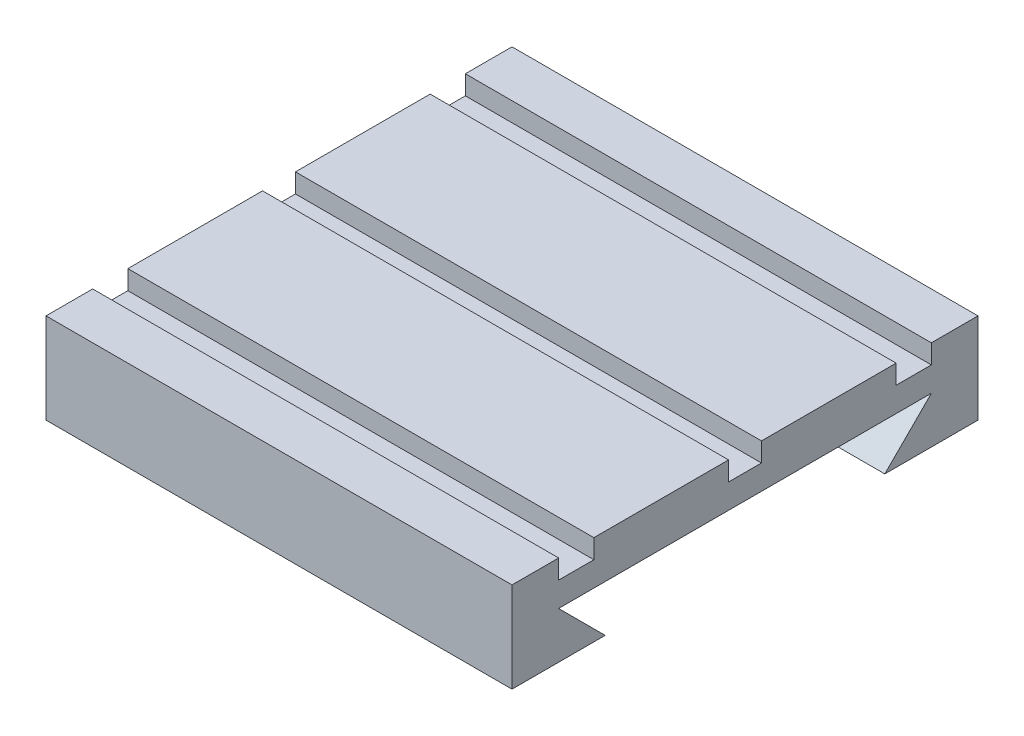
from build123d import *

# Parameters (mm, degrees)
SALIENTE_EXTRUIR1_DEPTH = 100
CROQUIS2_W              = 10.010901807
CROQUIS2_H              = 4.106706179
CROQUIS2_W_2            = 28.903824567
SALIENTE_EXTRUIR2_DEPTH = 100


with BuildPart() as part:
    # Croquis1 → Saliente-Extruir1 (new body)
    with BuildSketch(Plane(origin=(0, 0, 0), x_dir=(0, 0, -1), z_dir=(1, 0, 0))):
        Polygon((-30, 3.5), (-40, 13.5), (40, 13.5), (30, 3.5), (50, 3.5), (50, 18.770945102), (-50, 18.770945102), (-50, 3.5), align=None)
    extrude(amount=SALIENTE_EXTRUIR1_DEPTH)

    # Croquis2 → Saliente-Extruir2 (add)
    with BuildSketch(Plane(origin=(100, 0, 0), x_dir=(0, 0, -1), z_dir=(1, 0, 0))):
        with Locations((-44.994549097, 20.824298192)):
            Rectangle(CROQUIS2_W, CROQUIS2_H)
        with Locations((-17.982777217, 20.824298192)):
            Rectangle(CROQUIS2_W_2, CROQUIS2_H)
        with Locations((17.982777217, 20.824298192)):
            Rectangle(CROQUIS2_W_2, CROQUIS2_H)
        with Locations((44.994549097, 20.824298192)):
            Rectangle(CROQUIS2_W, CROQUIS2_H)
    extrude(amount=-SALIENTE_EXTRUIR2_DEPTH)


solid = part.part
